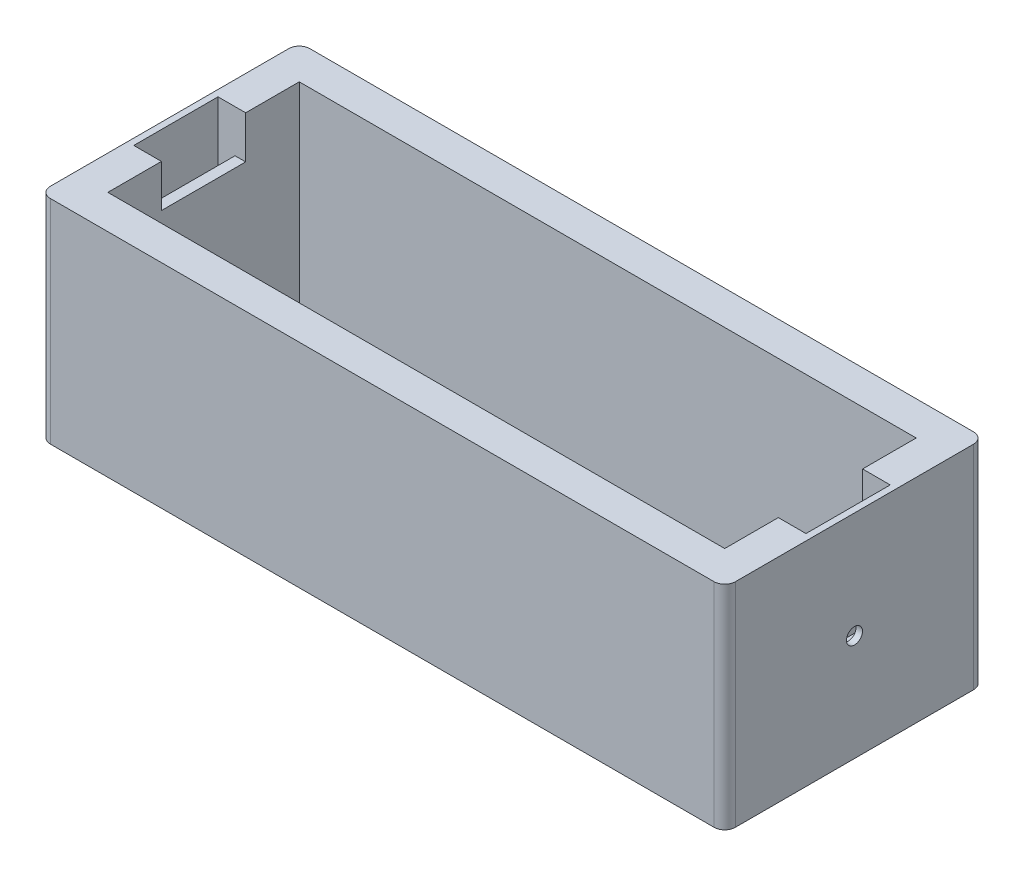
from build123d import *

# Parameters (mm, degrees)
SKETCH2_W               = 64.4
SKETCH2_H               = 24.4
BOSS_EXTRUDE1_DEPTH     = 20
SKETCH3_W               = 58
SKETCH3_H               = 18
CUT_EXTRUDE1_DEPTH      = 18
FILLET1_R               = 1
SKETCH4_W               = 1
SKETCH4_H               = 3.96
CUT_EXTRUDE2_DEPTH      = 4
SKETCH5_W               = 1.6
SKETCH5_H               = 3.96
CUT_EXTRUDE3_DEPTH      = 12
MIRROR5_COPY_1_SKETCH_W = 1
MIRROR5_COPY_1_SKETCH_H = 3.96
MIRROR5_COPY_1_DEPTH    = 4
MIRROR5_COPY_2_SKETCH_W = 1.6
MIRROR5_COPY_2_SKETCH_H = 3.96
MIRROR5_COPY_2_DEPTH    = 12
CUT_EXTRUDE4_REACH      = 70.529
SKETCH6_R               = 0.75


with BuildPart() as part:
    # Sketch2 → Boss-Extrude1 (new body)
    with BuildSketch(Plane(origin=(0, 0, 0), x_dir=(1, 0, 0), z_dir=(0, 1, 0))):
        Rectangle(SKETCH2_W, SKETCH2_H)
    extrude(amount=BOSS_EXTRUDE1_DEPTH)

    # Sketch3 → Cut-Extrude1 (cut)
    with BuildSketch(Plane(origin=(0, 20, 0), x_dir=(1, 0, 0), z_dir=(0, 1, 0))):
        Rectangle(SKETCH3_W, SKETCH3_H)
    extrude(amount=-CUT_EXTRUDE1_DEPTH, mode=Mode.SUBTRACT)

    # Fillet1
    fillet1_edges = [part.edges().sort_by_distance(p)[0] for p in [
        (32.2, 10, 12.2),
        (-32.2, 10, 12.2),
        (-32.2, 10, -12.2),
        (32.2, 10, -12.2),
    ]]
    fillet(fillet1_edges, radius=FILLET1_R)

    # Sketch4 → Cut-Extrude2 (cut)
    with BuildSketch(Plane(origin=(0, 20, 0), x_dir=(1, 0, 0), z_dir=(0, 1, 0))):
        with Locations((-29.5, 1.98)):
            Rectangle(SKETCH4_W, SKETCH4_H)
    cut_extrude2 = extrude(amount=-CUT_EXTRUDE2_DEPTH, mode=Mode.SUBTRACT)

    # Sketch5 → Cut-Extrude3 (cut)
    with BuildSketch(Plane(origin=(0, 20, 0), x_dir=(1, 0, 0), z_dir=(0, 1, 0))):
        with Locations((-30.8, 1.98)):
            Rectangle(SKETCH5_W, SKETCH5_H)
    cut_extrude3 = extrude(amount=-CUT_EXTRUDE3_DEPTH, mode=Mode.SUBTRACT)

    # Mirror4: Cut-Extrude2, Cut-Extrude3 across plane
    add(cut_extrude2.mirror(Plane(origin=(0, 0, 0), x_dir=(0, 0, 1), z_dir=(1, 0, 0))), mode=Mode.SUBTRACT)
    add(cut_extrude3.mirror(Plane(origin=(0, 0, 0), x_dir=(0, 0, 1), z_dir=(1, 0, 0))), mode=Mode.SUBTRACT)

    # Mirror5: Cut-Extrude2, Cut-Extrude3 across plane
    add(cut_extrude2.mirror(Plane.XY), mode=Mode.SUBTRACT)
    add(cut_extrude3.mirror(Plane.XY), mode=Mode.SUBTRACT)

    # Mirror5 copy 1 sketch → Mirror5 copy 1 (cut)
    with BuildSketch(Plane(origin=(0, 20, 0), x_dir=(-1, 0, 0), z_dir=(0, 1, 0))):
        with Locations((-29.5, 1.98)):
            Rectangle(MIRROR5_COPY_1_SKETCH_W, MIRROR5_COPY_1_SKETCH_H)
    extrude(amount=-MIRROR5_COPY_1_DEPTH, mode=Mode.SUBTRACT)

    # Mirror5 copy 2 sketch → Mirror5 copy 2 (cut)
    with BuildSketch(Plane(origin=(0, 20, 0), x_dir=(-1, 0, 0), z_dir=(0, 1, 0))):
        with Locations((-30.8, 1.98)):
            Rectangle(MIRROR5_COPY_2_SKETCH_W, MIRROR5_COPY_2_SKETCH_H)
    extrude(amount=-MIRROR5_COPY_2_DEPTH, mode=Mode.SUBTRACT)

    # Sketch6 → Cut-Extrude4 (cut, up to next)
    with BuildSketch(Plane(origin=(32.2, 0, 0), x_dir=(0, 0, -1), z_dir=(1, 0, 0)), mode=Mode.PRIVATE) as cut_extrude4_sk1:
        with Locations((0, 10)):
            Circle(SKETCH6_R)
    cut_extrude4_tool1 = extrude(cut_extrude4_sk1.sketch, amount=-CUT_EXTRUDE4_REACH, mode=Mode.PRIVATE) & part.part
    cut_extrude4 = cut_extrude4_tool1.solids().sort_by_distance((32.2, 10, 0))[0]
    add(cut_extrude4, mode=Mode.SUBTRACT)

    # Mirror6: Cut-Extrude4 across plane
    add(cut_extrude4.mirror(Plane(origin=(0, 0, 0), x_dir=(0, 0, 1), z_dir=(1, 0, 0))), mode=Mode.SUBTRACT)


solid = part.part
